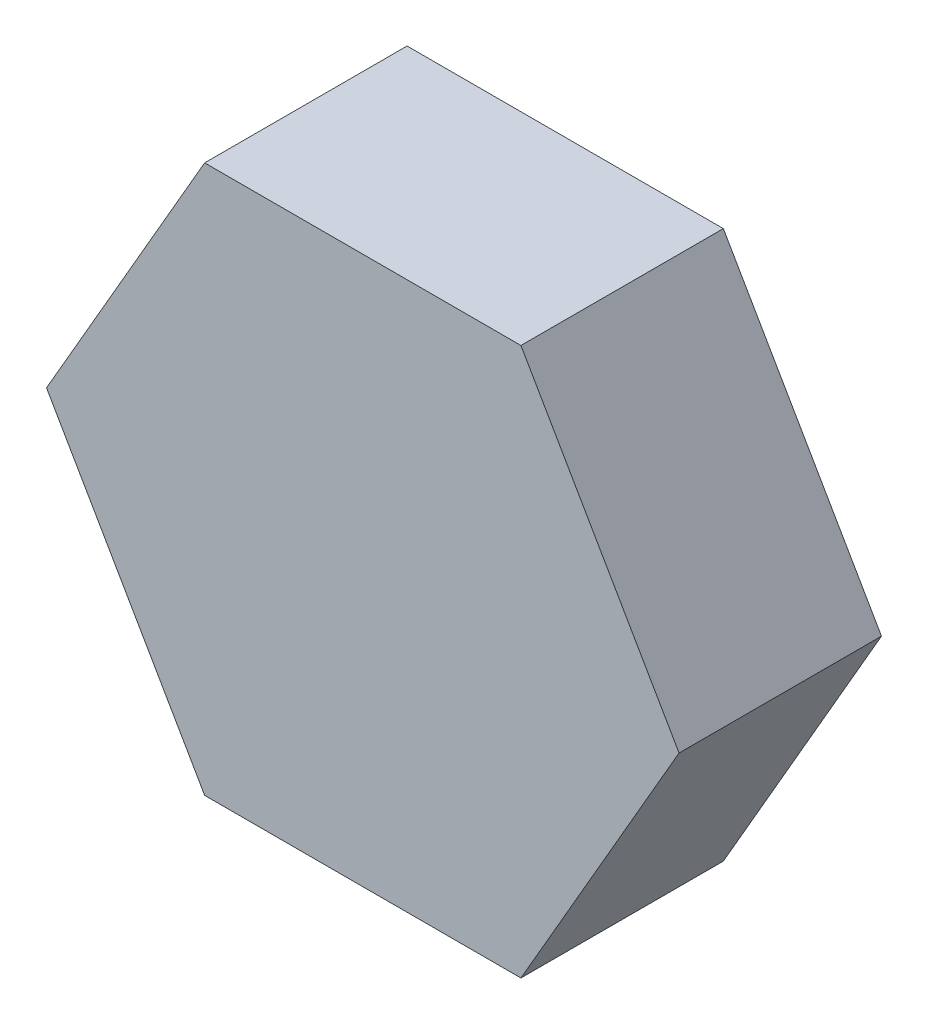
from build123d import *

# Parameters (mm, degrees)
BOSS_EXTRU_1_DEPTH = 24


with BuildPart() as part:
    # Esquisse2 → Boss.-Extru.1 (new body)
    with BuildSketch(Plane.XY):
        Polygon((37.5, 0), (18.75, 32.475952642), (-18.75, 32.475952642), (-37.5, 0), (-18.75, -32.475952642), (18.75, -32.475952642), align=None)
    extrude(amount=BOSS_EXTRU_1_DEPTH)


solid = part.part
